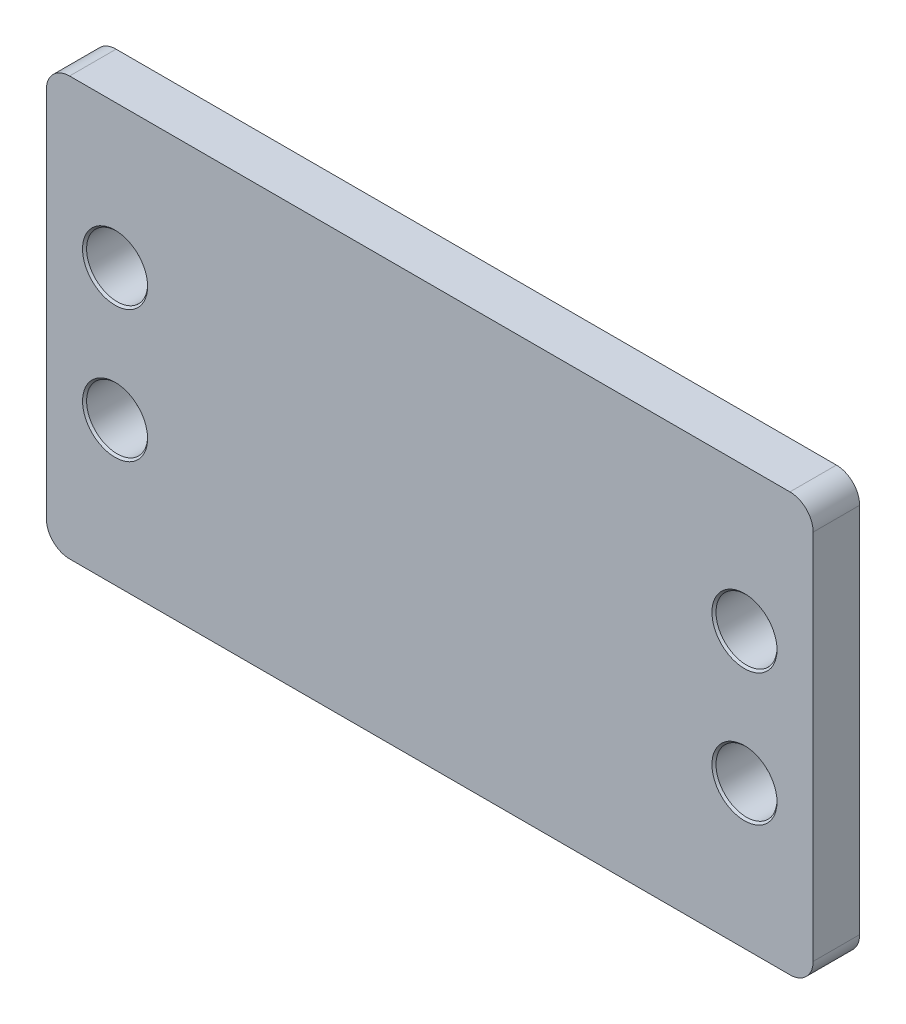
from build123d import *

# Parameters (mm, degrees)
SKETCH1_W                                 = 104.775
SKETCH1_H                                 = 57.15
BOSS_EXTRUDE1_DEPTH                       = 6.35
F_21_64_0_32813_DIAMETER_HOLE1_AT_2_COUNT = 2
F_21_64_0_32813_DIAMETER_HOLE1_AT_2_PITCH = 18
FILLET1_R                                 = 3.175


with BuildPart() as part:
    # Sketch1 → Boss-Extrude1 (new body)
    with BuildSketch(Plane.XY):
        Rectangle(SKETCH1_W, SKETCH1_H)
    extrude(amount=-BOSS_EXTRUDE1_DEPTH)

    # Sketch2 → 21/64 (0.32813) Diameter Hole1 (revolve, cut)
    with BuildSketch(Plane(origin=(43.000000106, 9, 0), x_dir=(0, -1, 0), z_dir=(1, 0, 0))):
        Polygon((0, 0), (0, 6.35), (4.445, 6.35), (4.167251, 6.072251), (4.167251, 0.277749), (4.445, 0), align=None)
    f_21_64_0_32813_diameter_hole1 = revolve(axis=Axis((43.000000106, 9, 6.35), (0, 0, -1)), mode=Mode.SUBTRACT)

    # 21/64 (0.32813) Diameter Hole1 at 2: 21/64 (0.32813) Diameter Hole1 ×2
    with Locations(*[(0, -i * F_21_64_0_32813_DIAMETER_HOLE1_AT_2_PITCH, 0) for i in range(1, F_21_64_0_32813_DIAMETER_HOLE1_AT_2_COUNT)]):
        add(f_21_64_0_32813_diameter_hole1, mode=Mode.SUBTRACT)

    # Mirror1: 21/64 (0.32813) Diameter Hole1 across plane
    add(f_21_64_0_32813_diameter_hole1.mirror(Plane(origin=(0, 0, 0), x_dir=(0, 0, 1), z_dir=(1, 0, 0))), mode=Mode.SUBTRACT)

    # Mirror1 copy 1 sketch → Mirror1 copy 1 (revolve, cut)
    with BuildSketch(Plane(origin=(-43.000000106, -9, 0), x_dir=(0, -1, 0), z_dir=(-1, 0, 0))):
        Polygon((0, 0), (0, -6.35), (4.445, -6.35), (4.167251, -6.072251), (4.167251, -0.277749), (4.445, 0), align=None)
    revolve(axis=Axis((-43.000000106, -9, 6.35), (0, 0, 1)), mode=Mode.SUBTRACT)

    # Fillet1
    fillet1_edges = [part.edges().sort_by_distance(p)[0] for p in [
        (-52.3875, 28.575, -3.175),
        (52.3875, 28.575, -3.175),
        (52.3875, -28.575, -3.175),
        (-52.3875, -28.575, -3.175),
    ]]
    fillet(fillet1_edges, radius=FILLET1_R)


solid = part.part
